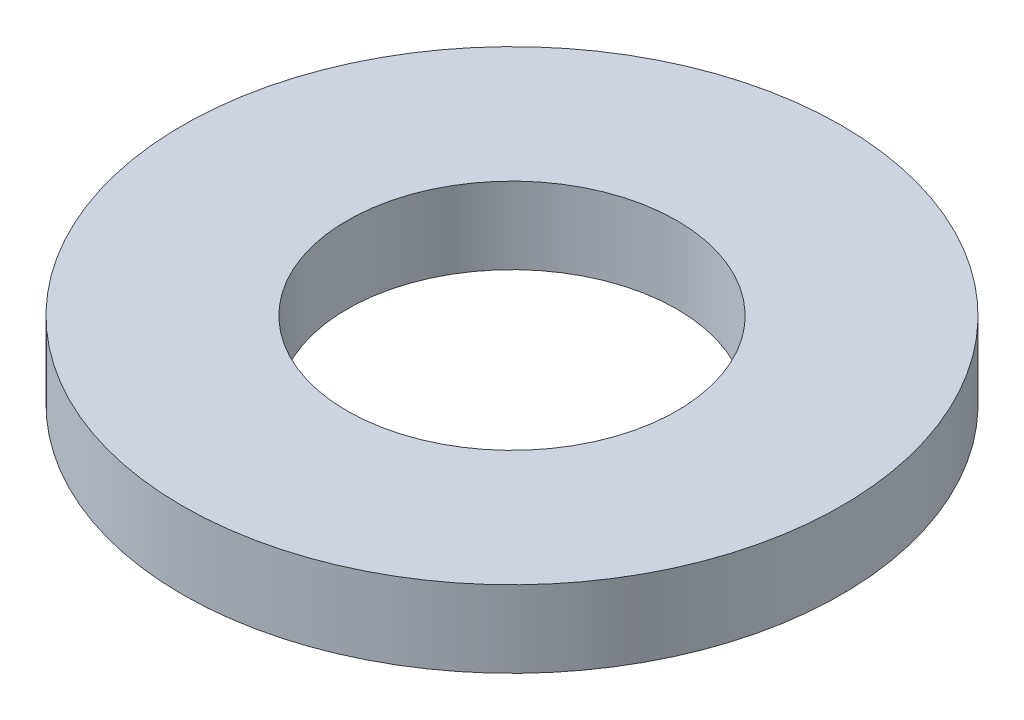
from build123d import *

# Parameters (mm, degrees)
SKETCH1_R           = 8.73125
BOSS_EXTRUDE1_DEPTH = 2.032
SKETCH5_R           = 4.3688
CUT_EXTRUDE1_DEPTH  = 13.513931322


with BuildPart() as part:
    # Sketch1 → Boss-Extrude1 (new body)
    with BuildSketch(Plane(origin=(0, 0, 0), x_dir=(1, 0, 0), z_dir=(0, 1, 0))):
        with Locations(Location((0, 0, 0), (0, 0, 270))):
            Circle(SKETCH1_R)
    extrude(amount=BOSS_EXTRUDE1_DEPTH)

    # Sketch5 → Cut-Extrude1 (cut, through all)
    with BuildSketch(Plane(origin=(0, 2.032, 0), x_dir=(-1, 0, 0), z_dir=(0, 1, 0))):
        with Locations(Location((0, 0, 0), (0, 0, 90))):
            Circle(SKETCH5_R)
    extrude(amount=-CUT_EXTRUDE1_DEPTH, mode=Mode.SUBTRACT)


solid = part.part
